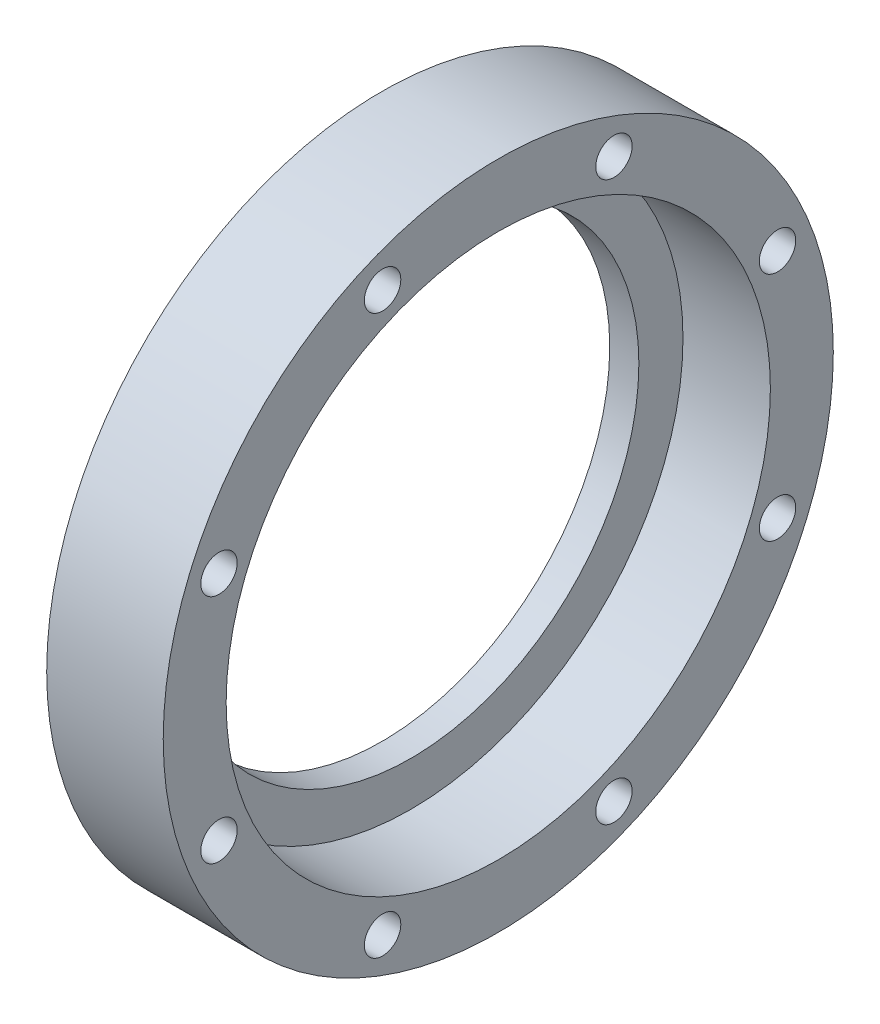
from build123d import *

# Parameters (mm, degrees)
SKETCH_1_R      = 18.68
SKETCH_1_R_2    = 15.652173913
EXTRUDE_2_DEPTH = 2
SKETCH_1_4_R    = 23
SKETCH_1_4_R_2  = 1.25
SKETCH_1_4_R_3  = 18.68
EXTRUDE_3_DEPTH = 8


with BuildPart() as part:
    # 草图1 → 凸台-拉伸2 (new body)
    with BuildSketch(Plane(origin=(0, 0, 0), x_dir=(0, 0, -1), z_dir=(1, 0, 0))):
        Circle(SKETCH_1_R)
        Circle(SKETCH_1_R_2, mode=Mode.SUBTRACT)
    extrude(amount=EXTRUDE_2_DEPTH)

    # 草图1<4> → 凸台-拉伸3 (add)
    with BuildSketch(Plane(origin=(0, 0, 0), x_dir=(0, 0, -1), z_dir=(1, 0, 0))):
        Circle(SKETCH_1_4_R)
        with Locations((-7.940681222, -19.1705003)):
            Circle(SKETCH_1_4_R_2, mode=Mode.SUBTRACT)
        with Locations((-19.1705003, -7.940681222)):
            Circle(SKETCH_1_4_R_2, mode=Mode.SUBTRACT)
        with Locations((7.940681222, -19.1705003)):
            Circle(SKETCH_1_4_R_2, mode=Mode.SUBTRACT)
        with Locations((19.1705003, -7.940681222)):
            Circle(SKETCH_1_4_R_2, mode=Mode.SUBTRACT)
        with Locations((-19.1705003, 7.940681222)):
            Circle(SKETCH_1_4_R_2, mode=Mode.SUBTRACT)
        with Locations((-7.940681222, 19.1705003)):
            Circle(SKETCH_1_4_R_2, mode=Mode.SUBTRACT)
        Circle(SKETCH_1_4_R_3, mode=Mode.SUBTRACT)
        with Locations((19.1705003, 7.940681222)):
            Circle(SKETCH_1_4_R_2, mode=Mode.SUBTRACT)
        with Locations((7.940681222, 19.1705003)):
            Circle(SKETCH_1_4_R_2, mode=Mode.SUBTRACT)
    extrude(amount=EXTRUDE_3_DEPTH)


solid = part.part
